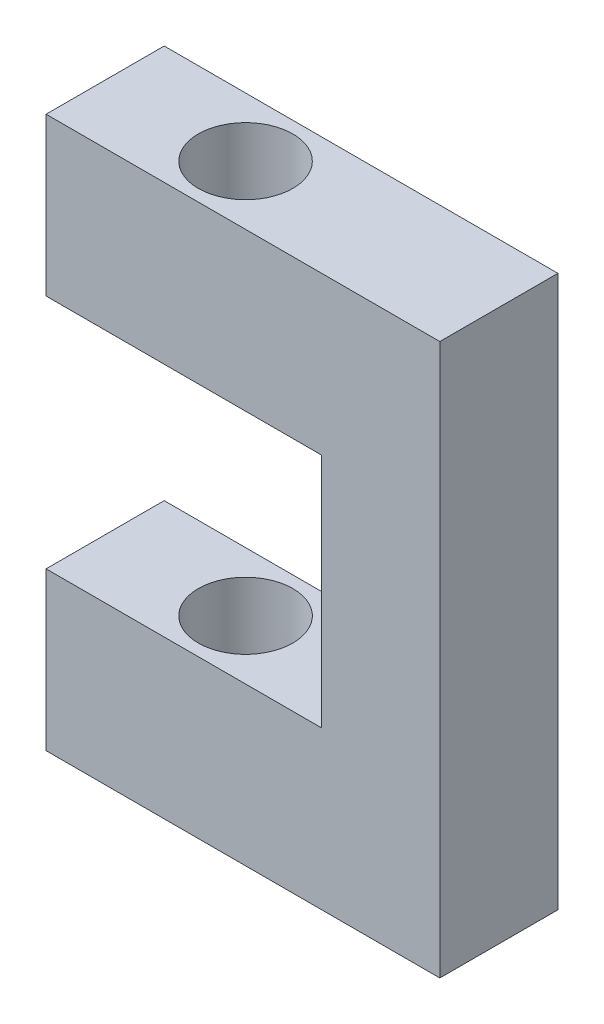
from build123d import *

# Parameters (mm, degrees)
BOSS_EXTRUDE1_DEPTH = 15
SKETCH5_R           = 6
CUT_EXTRUDE1_DEPTH  = 81


with BuildPart() as part:
    # Sketch3 → Boss-Extrude1 (new body)
    with BuildSketch(Plane.XY):
        Polygon((0, 0), (50, 0), (50, -70), (0, -70), (0, -50), (35, -50), (35, -20), (0, -20), align=None)
    extrude(amount=BOSS_EXTRUDE1_DEPTH)

    # Sketch5 → Cut-Extrude1 (cut)
    with BuildSketch(Plane(origin=(0, 0, 0), x_dir=(1, 0, 0), z_dir=(0, 1, 0))):
        with Locations(Location((17.831915018, -7.5, 0), (0, 0, 270))):
            Circle(SKETCH5_R)
    extrude(amount=-CUT_EXTRUDE1_DEPTH, mode=Mode.SUBTRACT)


solid = part.part
